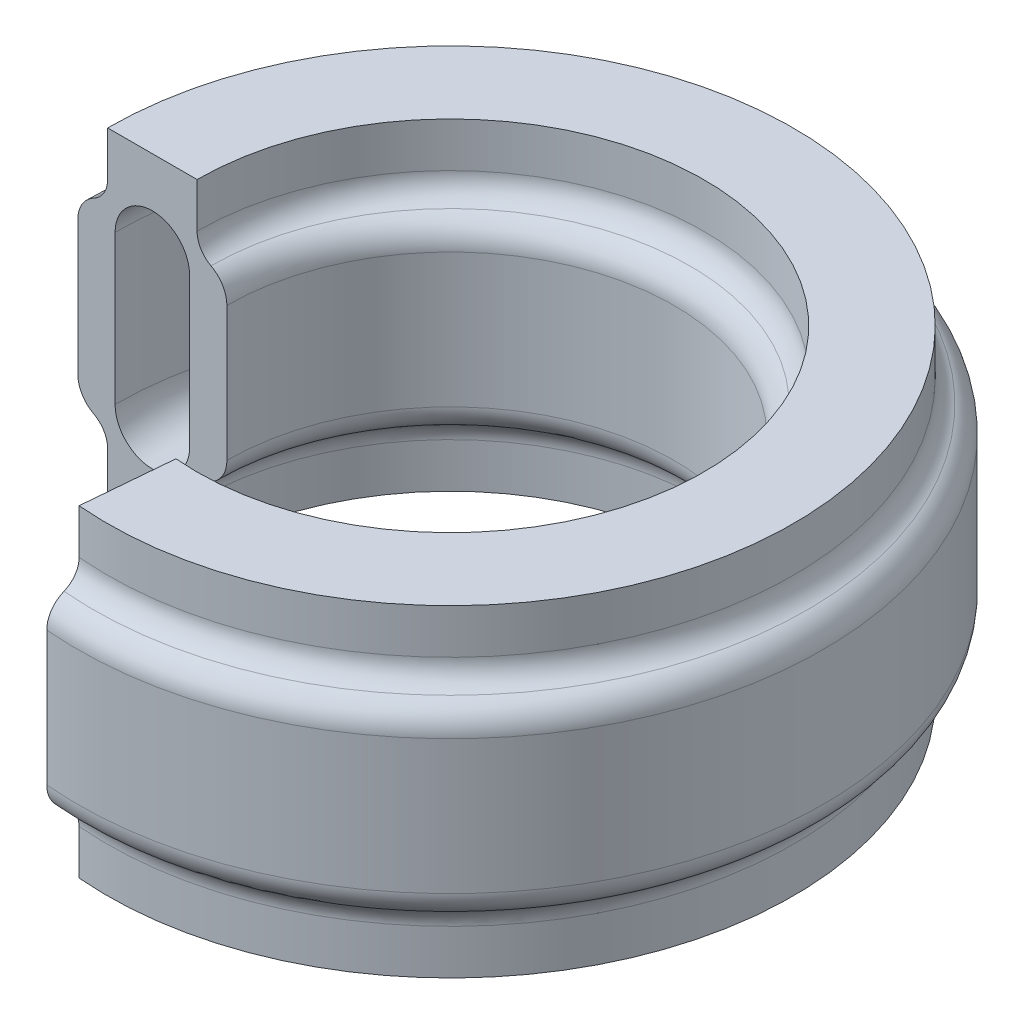
from build123d import *

# Parameters (mm, degrees)
REVOLVE1_ANGLE = 275


with BuildPart() as part:
    # Sketch1 → Revolve1 (revolve)
    with BuildSketch(Plane.XY):
        with BuildLine():
            Line((-17, 11.164422538), (-23, 11.164422538))
            Line((-23, 11.164422538), (-23, 8.164422538))
            ThreePointArc((-23, 8.164422538), (-23.251389532, 7.260726424), (-23.933333333, 6.616664303))
            ThreePointArc((-23.933333333, 6.616664303), (-24.712697677, 5.880593307), (-25, 4.847797748))
            Line((-25, 4.847797748), (-25, -4.152202252))
            ThreePointArc((-25, -4.152202252), (-24.712697677, -5.184997811), (-23.933333333, -5.921068807))
            ThreePointArc((-23.933333333, -5.921068807), (-23.251389532, -6.565130928), (-23, -7.468827042))
            Line((-23, -7.468827042), (-23, -10.468827042))
            Line((-23, -10.468827042), (-17, -10.468827042))
            Line((-17, -10.468827042), (-17, -7.468827042))
            ThreePointArc((-17, -7.468827042), (-16.748610468, -6.565130928), (-16.066666667, -5.921068807))
            ThreePointArc((-16.066666667, -5.921068807), (-15.287302323, -5.184997811), (-15, -4.152202252))
            Line((-15, -4.152202252), (-15, 4.847797748))
            ThreePointArc((-15, 4.847797748), (-15.287302323, 5.880593307), (-16.066666667, 6.616664303))
            ThreePointArc((-16.066666667, 6.616664303), (-16.748610468, 7.260726424), (-17, 8.164422538))
            Line((-17, 8.164422538), (-17, 11.164422538))
        make_face()
        with BuildLine():
            Line((-22.5, 5.347797748), (-22.5, -4.652202252))
            ThreePointArc((-22.5, -4.652202252), (-20, -7.152202252), (-17.5, -4.652202252))
            Line((-17.5, -4.652202252), (-17.5, 5.347797748))
            ThreePointArc((-17.5, 5.347797748), (-20, 7.847797748), (-22.5, 5.347797748))
        make_face(mode=Mode.SUBTRACT)
    revolve(axis=Axis((0, 17.689062813, 0), (0, -1, 0)), revolution_arc=REVOLVE1_ANGLE)


solid = part.part
